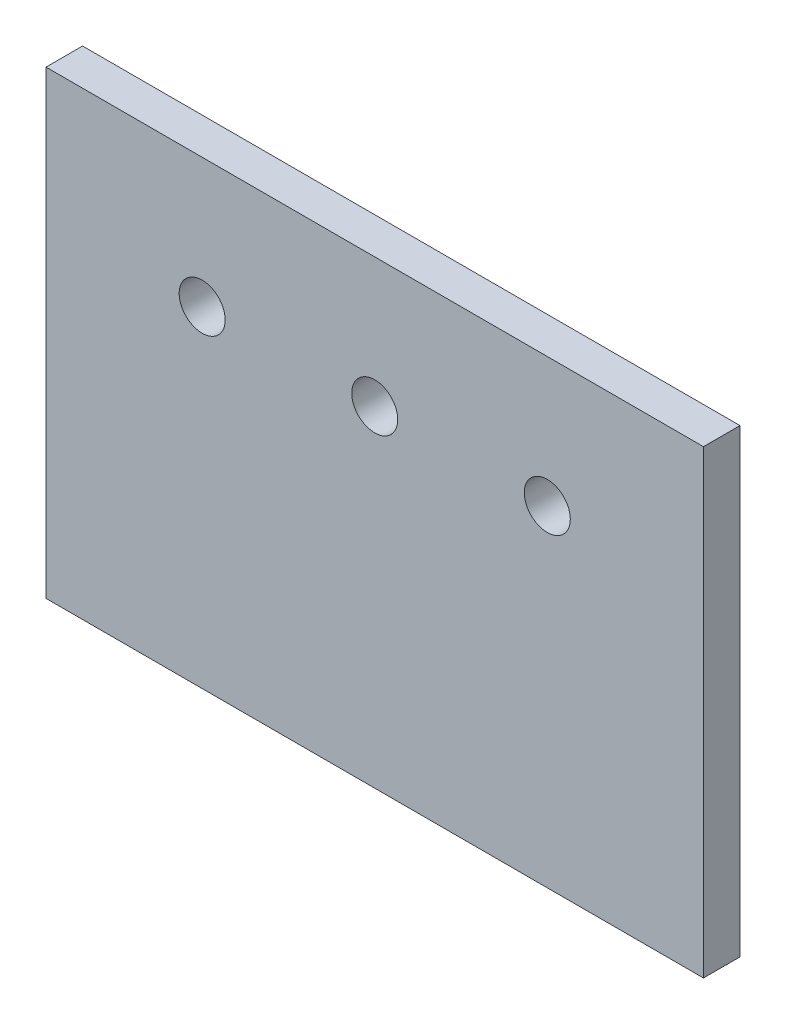
from build123d import *

# Parameters (mm, degrees)
SKETCH1_W           = 114.3
SKETCH1_H           = 80
SKETCH1_R           = 4
BOSS_EXTRUDE1_DEPTH = 6.35


with BuildPart() as part:
    # Sketch1 → Boss-Extrude1 (new body)
    with BuildSketch(Plane.XY):
        with Locations((57.15, -40)):
            Rectangle(SKETCH1_W, SKETCH1_H)
        with Locations((57.15, -22.5)):
            Circle(SKETCH1_R, mode=Mode.SUBTRACT)
        with Locations((27.15, -22.5)):
            Circle(SKETCH1_R, mode=Mode.SUBTRACT)
        with Locations((87.15, -22.5)):
            Circle(SKETCH1_R, mode=Mode.SUBTRACT)
    extrude(amount=BOSS_EXTRUDE1_DEPTH)


solid = part.part
